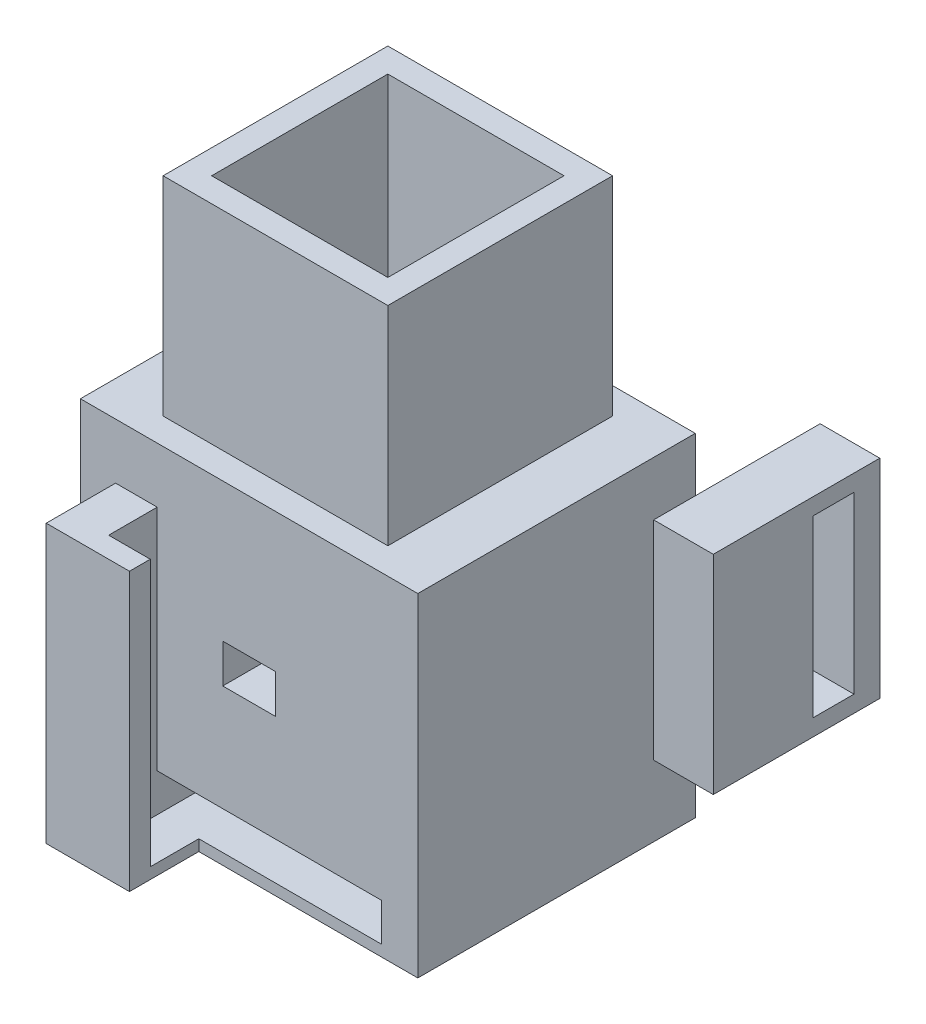
from build123d import *

# Parameters (mm, degrees)
SKETCH_1_W           = 16.2
SKETCH_1_H           = 16.2
SKETCH_1_W_2         = 12.7
SKETCH_1_H_2         = 12.7
EXTRUDE_1_DEPTH      = 39
SKETCH_3_W           = 12.7
SKETCH_3_H           = 12.7
EXTRUDE_2_DEPTH      = 4
SKETCH_5_W           = 24.32
SKETCH_5_H           = 20
SKETCH_5_W_2         = 14.7
SKETCH_5_H_2         = 14.7
EXTRUDE_3_DEPTH      = 20
SKETCH_9_W           = 2.74
SKETCH_9_H           = 10.6
CUT_EXTRUDE_5_DEPTH  = 8.416671881
SKETCH_13_W          = 8.4
SKETCH_13_H          = 8.4
SKETCH_13_W_2        = 5.6
SKETCH_13_H_2        = 5.6
EXTRUDE_6_DEPTH      = 5.1
SKETCH_27_W          = 5.6
SKETCH_27_H          = 5.6
SKETCH_27_R          = 2.65
EXTRUDE_10_DEPTH     = 3.7
CUT_EXTRUDE_10_REACH = 47.485
SKETCH_33_R          = 2.65
CUT_EXTRUDE_13_REACH = 49.947
SKETCH_23_W          = 3.8
SKETCH_23_H          = 2.8
SKETCH_34_W          = 24.32
SKETCH_34_H          = 20
SKETCH_34_W_2        = 16.2
SKETCH_34_H_2        = 16.2
EXTRUDE_11_DEPTH     = 4
SKETCH_35_W          = 3
SKETCH_35_H          = 15
EXTRUDE_12_DEPTH     = 4.3
SKETCH_38_W          = 4.3
SKETCH_38_H          = 15
EXTRUDE_13_DEPTH     = 9
CUT_EXTRUDE_14_REACH = 53.972
SKETCH_39_W          = 2.94
SKETCH_39_H          = 12.6
SKETCH_23_4_W        = 13.25
SKETCH_23_4_H        = 2.74
CUT_EXTRUDE_16_DEPTH = 10
SKETCH_42_W          = 3
SKETCH_42_H          = 19.2
EXTRUDE_14_DEPTH     = 5
SKETCH_45_W          = 1.5
SKETCH_45_H          = 19.2
EXTRUDE_15_DEPTH     = 3
SKETCH_46_W          = 2.935
SKETCH_46_H          = 2.74
CUT_EXTRUDE_18_DEPTH = 10
CUT_EXTRUDE_19_REACH = 48.4
SKETCH_47_W          = 10.6
SKETCH_47_H          = 2.74
SKETCH_49_W          = 6
SKETCH_49_H          = 0.8
EXTRUDE_17_DEPTH     = 5


with BuildPart() as part:
    # 草圖1 → 填料-伸長1 (new body)
    with BuildSketch(Plane(origin=(0, 0, 0), x_dir=(1, 0, 0), z_dir=(0, 1, 0))):
        Rectangle(SKETCH_1_W, SKETCH_1_H)
        Rectangle(SKETCH_1_W_2, SKETCH_1_H_2, mode=Mode.SUBTRACT)
    extrude(amount=EXTRUDE_1_DEPTH)



with BuildPart() as body_2:
    # 草圖3 → 填料-伸長2 (new body)
    with BuildSketch(Plane(origin=(0, 0, 0), x_dir=(1, 0, 0), z_dir=(0, 1, 0))):
        Rectangle(SKETCH_3_W, SKETCH_3_H)
    extrude(amount=EXTRUDE_2_DEPTH)


with BuildPart() as part_1:
    add(part.part)

    add(body_2.part)  # 填料-伸長3 merges body 2
    # 草圖5 → 填料-伸長3 (add)
    with BuildSketch(Plane(origin=(0, 0, 0), x_dir=(1, 0, 0), z_dir=(0, 1, 0))):
        Rectangle(SKETCH_5_W, SKETCH_5_H)
        Rectangle(SKETCH_5_W_2, SKETCH_5_H_2, mode=Mode.SUBTRACT)
    extrude(amount=EXTRUDE_3_DEPTH)

    # 草圖9 → 除料-伸長5 (cut)
    with BuildSketch(Plane(origin=(0, 0, 0), x_dir=(1, 0, 0), z_dir=(0, 1, 0))):
        with Locations((-8.89, 0)):
            Rectangle(SKETCH_9_W, SKETCH_9_H)
        with Locations((8.89, 0)):
            Rectangle(SKETCH_9_W, SKETCH_9_H)
    extrude(amount=CUT_EXTRUDE_5_DEPTH, mode=Mode.SUBTRACT)

    # 草圖13 → 填料-伸長6 (add)
    with BuildSketch(Plane(origin=(0, 0, -10), x_dir=(-1, 0, 0), z_dir=(0, 0, -1))):
        with Locations((0, 12.6)):
            Rectangle(SKETCH_13_W, SKETCH_13_H)
        with Locations((0, 12.6)):
            Rectangle(SKETCH_13_W_2, SKETCH_13_H_2, mode=Mode.SUBTRACT)
    extrude(amount=EXTRUDE_6_DEPTH)

    # 草圖27 → 填料-伸長10 (add)
    with BuildSketch(Plane(origin=(0, 0, -10), x_dir=(-1, 0, 0), z_dir=(0, 0, -1))):
        with Locations((0, 12.6)):
            Rectangle(SKETCH_27_W, SKETCH_27_H)
        with Locations((0, 12.6)):
            Circle(SKETCH_27_R, mode=Mode.SUBTRACT)
    extrude(amount=EXTRUDE_10_DEPTH)

    # 草圖33 → 除料-伸長10 (cut, up to next)
    with BuildSketch(Plane(origin=(0, 0, -10), x_dir=(-1, 0, 0), z_dir=(0, 0, -1)), mode=Mode.PRIVATE) as cut_extrude_10_sk1:
        with Locations((0, 12.6)):
            Circle(SKETCH_33_R)
    cut_extrude_10_tool1 = extrude(cut_extrude_10_sk1.sketch, amount=-CUT_EXTRUDE_10_REACH, mode=Mode.PRIVATE) & part_1.part
    add(cut_extrude_10_tool1.solids().sort_by_distance((0, 12.6, -10))[0], mode=Mode.SUBTRACT)

    # 草圖23 → 除料-伸長13 (cut, up to next)
    with BuildSketch(Plane.XY.offset(10), mode=Mode.PRIVATE) as cut_extrude_13_sk1:
        with Locations((0, 12.6)):
            Rectangle(SKETCH_23_W, SKETCH_23_H)
    cut_extrude_13_tool1 = extrude(cut_extrude_13_sk1.sketch, amount=-CUT_EXTRUDE_13_REACH, mode=Mode.PRIVATE) & part_1.part
    add(cut_extrude_13_tool1.solids().sort_by_distance((0, 12.6, 10))[0], mode=Mode.SUBTRACT)

    # 草圖34 → 填料-伸長11 (add)
    with BuildSketch(Plane(origin=(0, 20, 0), x_dir=(1, 0, 0), z_dir=(0, 1, 0))):
        Rectangle(SKETCH_34_W, SKETCH_34_H)
        Rectangle(SKETCH_34_W_2, SKETCH_34_H_2, mode=Mode.SUBTRACT)
    extrude(amount=EXTRUDE_11_DEPTH)

    # 草圖35 → 填料-伸長12 (add)
    with BuildSketch(Plane(origin=(12.16, 0, 0), x_dir=(0, 0, -1), z_dir=(1, 0, 0))):
        with Locations((8.5, 12.6)):
            Rectangle(SKETCH_35_W, SKETCH_35_H)
    extrude(amount=EXTRUDE_12_DEPTH)

    # 草圖38 → 填料-伸長13 (add)
    with BuildSketch(Plane(origin=(0, 0, -10), x_dir=(-1, 0, 0), z_dir=(0, 0, -1))):
        with Locations((-14.31, 12.6)):
            Rectangle(SKETCH_38_W, SKETCH_38_H)
    extrude(amount=EXTRUDE_13_DEPTH)

    # 草圖39 → 除料-伸長14 (cut, up to next)
    with BuildSketch(Plane(origin=(16.46, 0, 0), x_dir=(0, 0, -1), z_dir=(1, 0, 0)), mode=Mode.PRIVATE) as cut_extrude_14_sk1:
        with Locations((15.67, 12.6)):
            Rectangle(SKETCH_39_W, SKETCH_39_H)
    cut_extrude_14_tool1 = extrude(cut_extrude_14_sk1.sketch, amount=-CUT_EXTRUDE_14_REACH, mode=Mode.PRIVATE) & part_1.part
    add(cut_extrude_14_tool1.solids().sort_by_distance((16.46, 12.6, -15.67))[0], mode=Mode.SUBTRACT)

    # 草圖23<4> → 除料-伸長16 (cut)
    with BuildSketch(Plane.XY.offset(10)):
        with Locations((0, 2.17)):
            Rectangle(SKETCH_23_4_W, SKETCH_23_4_H)
    extrude(amount=-CUT_EXTRUDE_16_DEPTH, mode=Mode.SUBTRACT)

    # 草圖42 → 填料-伸長14 (add)
    with BuildSketch(Plane.XY.offset(10)):
        with Locations((-8.125, 10.4)):
            Rectangle(SKETCH_42_W, SKETCH_42_H)
    extrude(amount=EXTRUDE_14_DEPTH)

    # 草圖45 → 填料-伸長15 (add)
    with BuildSketch(Plane(origin=(-6.625, 0, 0), x_dir=(0, 0, -1), z_dir=(1, 0, 0))):
        with Locations((-14.25, 10.4)):
            Rectangle(SKETCH_45_W, SKETCH_45_H)
    extrude(amount=EXTRUDE_15_DEPTH)

    # 草圖46 → 除料-伸長18 (cut)
    with BuildSketch(Plane.XY.offset(10)):
        with Locations((8.0925, 2.17)):
            Rectangle(SKETCH_46_W, SKETCH_46_H)
    extrude(amount=-CUT_EXTRUDE_18_DEPTH, mode=Mode.SUBTRACT)

    # 草圖47 → 除料-伸長19 (cut, up to next)
    with BuildSketch(Plane.XY, mode=Mode.PRIVATE) as cut_extrude_19_sk1:
        with Locations((-1.325, 2.17)):
            Rectangle(SKETCH_47_W, SKETCH_47_H)
    cut_extrude_19_tool1 = extrude(cut_extrude_19_sk1.sketch, amount=-CUT_EXTRUDE_19_REACH, mode=Mode.PRIVATE) & part_1.part
    add(cut_extrude_19_tool1.solids().sort_by_distance((-1.325, 2.17, 0))[0], mode=Mode.SUBTRACT)

    # 草圖49 → 填料-伸長17 (add)
    with BuildSketch(Plane.XY.offset(10)):
        with Locations((-6.625, 0.4)):
            Rectangle(SKETCH_49_W, SKETCH_49_H)
    extrude(amount=EXTRUDE_17_DEPTH)


solid = part_1.part
